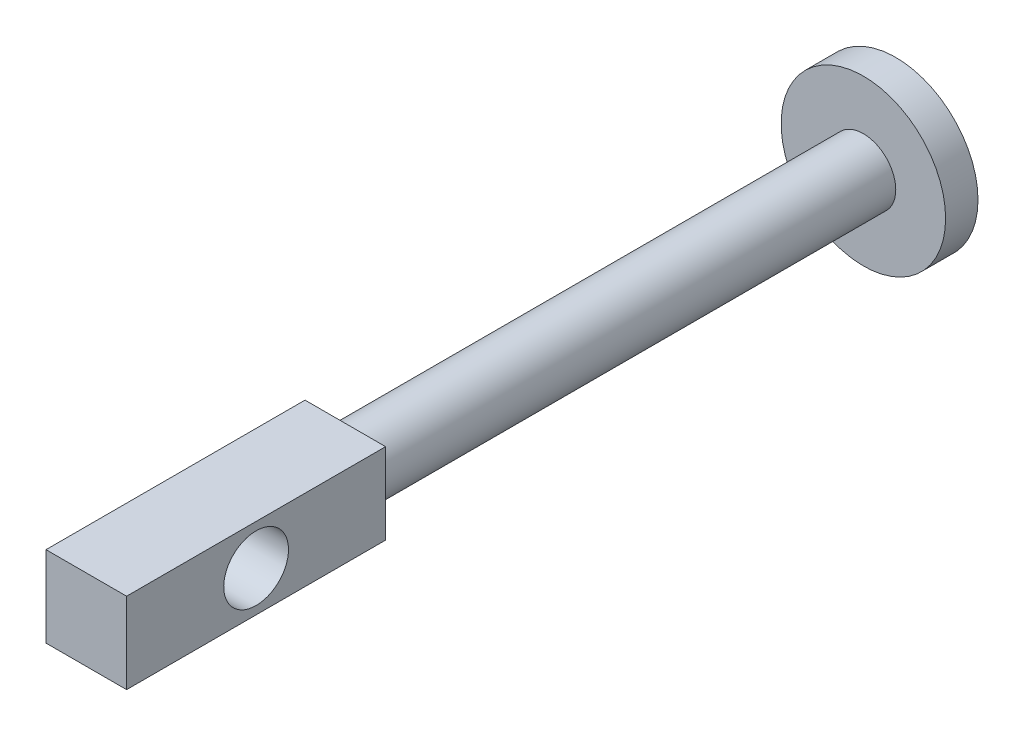
from build123d import *

# Parameters (mm, degrees)
SKETCH1_R           = 12.7
BOSS_EXTRUDE1_DEPTH = 5
SKETCH2_R           = 5
BOSS_EXTRUDE3_DEPTH = 80
SKETCH3_W           = 12.446
SKETCH3_H           = 12.5
BOSS_EXTRUDE4_DEPTH = 40
SKETCH4_R           = 5
CUT_EXTRUDE1_DEPTH  = 128.060497122


with BuildPart() as part:
    # Sketch1 → Boss-Extrude1 (new body)
    with BuildSketch(Plane.XY):
        Circle(SKETCH1_R)
    extrude(amount=BOSS_EXTRUDE1_DEPTH)

    # Sketch2 → Boss-Extrude3 (add)
    with BuildSketch(Plane.XY.offset(5)):
        Circle(SKETCH2_R)
    extrude(amount=BOSS_EXTRUDE3_DEPTH)

    # Sketch3 → Boss-Extrude4 (add)
    with BuildSketch(Plane.XY.offset(85)):
        Rectangle(SKETCH3_W, SKETCH3_H)
    extrude(amount=BOSS_EXTRUDE4_DEPTH)

    # Sketch4 → Cut-Extrude1 (cut, through all)
    with BuildSketch(Plane.ZY.offset(6.223)):
        with Locations(Location((105, 0, 0), (0, 0, 270))):
            Circle(SKETCH4_R)
    extrude(amount=-CUT_EXTRUDE1_DEPTH, mode=Mode.SUBTRACT)


solid = part.part
